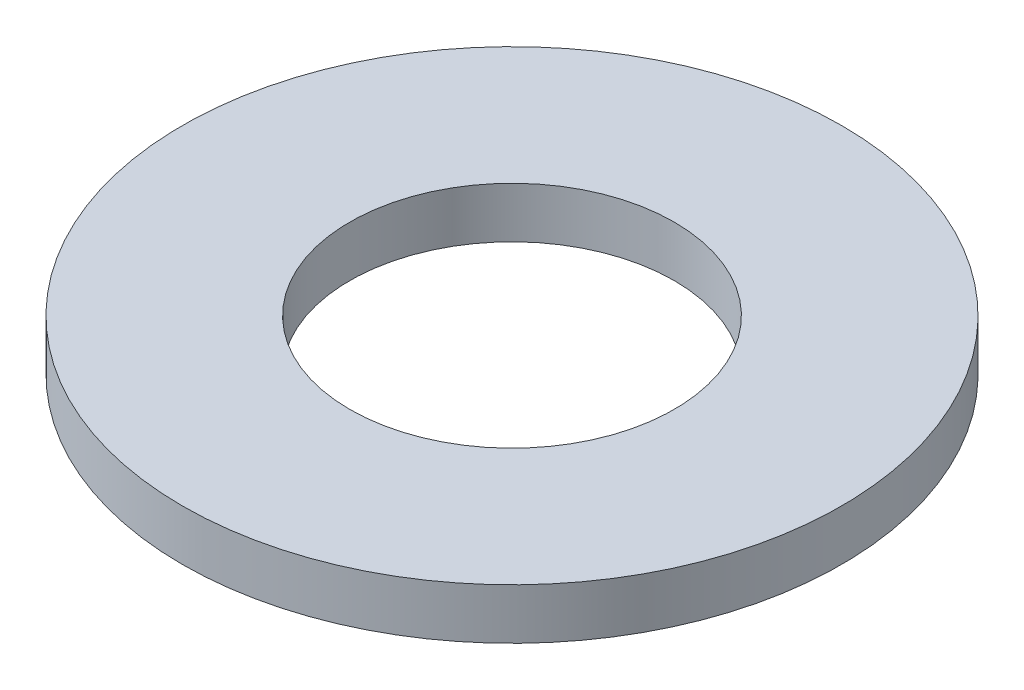
from build123d import *

# Parameters (mm, degrees)
SKETCH1_R           = 3.25
SKETCH1_R_2         = 1.6
BOSS_EXTRUDE1_DEPTH = 0.5


with BuildPart() as part:
    # Sketch1 → Boss-Extrude1 (new body)
    with BuildSketch(Plane(origin=(0, 0, 0), x_dir=(1, 0, 0), z_dir=(0, 1, 0))):
        with Locations(Location((0, 0, 0), (0, 0, 270))):
            Circle(SKETCH1_R)
        with Locations(Location((0, 0, 0), (0, 0, 270))):
            Circle(SKETCH1_R_2, mode=Mode.SUBTRACT)
    extrude(amount=BOSS_EXTRUDE1_DEPTH)


solid = part.part
